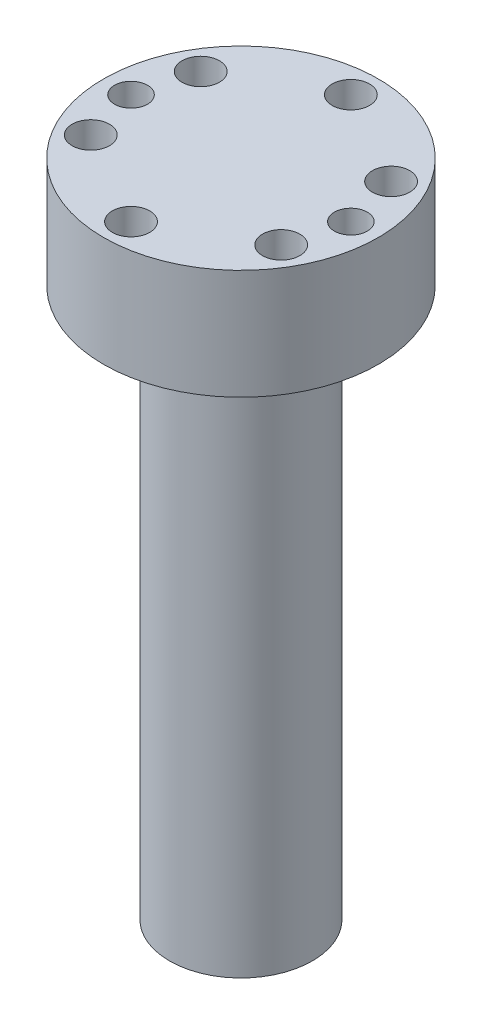
from build123d import *

# Parameters (mm, degrees)
SKETCH1_R             = 12.5
BOSS_EXTRUDE1_DEPTH   = 10
M3_CLEARANCE_HOLE1_D  = 3.4
F_3_0MM_DOWEL_HOLE1_D = 3
SKETCH7_R             = 6.5
BOSS_EXTRUDE2_DEPTH   = 50


with BuildPart() as part:
    # Sketch1 → Boss-Extrude1 (new body)
    with BuildSketch(Plane(origin=(0, 0, 0), x_dir=(1, 0, 0), z_dir=(0, 1, 0))):
        with Locations(Location((0, 0, 0), (0, 0, 270))):
            Circle(SKETCH1_R)
    extrude(amount=BOSS_EXTRUDE1_DEPTH)

    # M3 Clearance Hole1 (through all)
    with Locations(Plane(origin=(0, 10, 0), x_dir=(1, 0, 0), z_dir=(0, 1, 0))):
        with Locations((-8.660254038, 5), (0, 10), (8.660254038, 5), (8.660254038, -5), (0, -10), (-8.660254038, -5)):
            Hole(M3_CLEARANCE_HOLE1_D / 2)

    # Ø3.0mm Dowel Hole1 (through all)
    with Locations(Plane(origin=(0, 10, 0), x_dir=(1, 0, 0), z_dir=(0, 1, 0))):
        with Locations((-10, 0), (10, 0)):
            Hole(F_3_0MM_DOWEL_HOLE1_D / 2)

    # Sketch7 → Boss-Extrude2 (add)
    with BuildSketch(Plane(origin=(0, 0, 0), x_dir=(1, 0, 0), z_dir=(0, 1, 0))):
        with Locations(Location((0, 0, 0), (0, 0, 270))):
            Circle(SKETCH7_R)
    extrude(amount=-BOSS_EXTRUDE2_DEPTH)


solid = part.part
